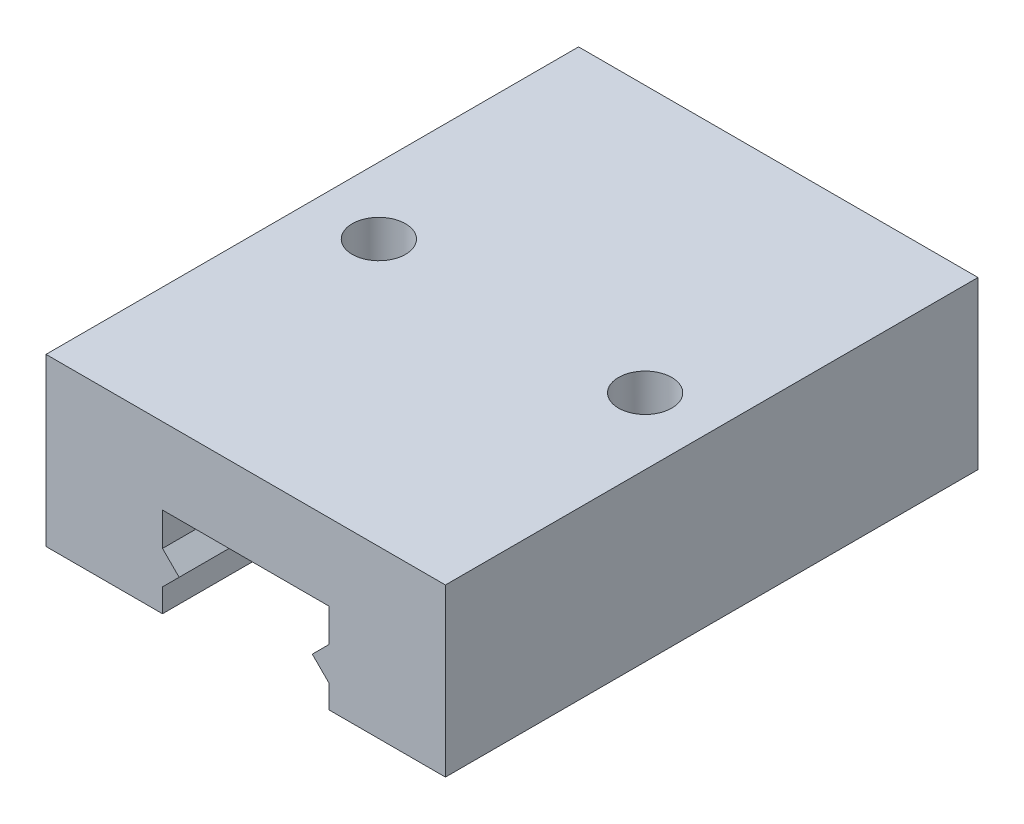
from build123d import *

# Parameters (mm, degrees)
BOSS_EXTRUDE1_DEPTH = 16
SKETCH2_R           = 0.8
CUT_EXTRUDE1_DEPTH  = 16


with BuildPart() as part:
    # Sketch1 → Boss-Extrude1 (new body)
    with BuildSketch(Plane.XY):
        Polygon((6, 0), (-6, 0), (-6, -5), (-2.5, -5), (-2.5, -4.3), (-2, -3.8), (-2.5, -3.3), (-2.5, -2.3), (2.5, -2.3), (2.5, -3.3), (2, -3.8), (2.5, -4.3), (2.5, -5), (6, -5), align=None)
    extrude(amount=BOSS_EXTRUDE1_DEPTH)

    # Sketch2 → Cut-Extrude1 (cut)
    with BuildSketch(Plane(origin=(0, 0, 0), x_dir=(1, 0, 0), z_dir=(0, 1, 0))):
        with Locations(Location((-4, -8, 0), (0, 0, 270))):
            Circle(SKETCH2_R)
        with Locations(Location((4, -8, 0), (0, 0, 270))):
            Circle(SKETCH2_R)
    extrude(amount=-CUT_EXTRUDE1_DEPTH, mode=Mode.SUBTRACT)


solid = part.part
